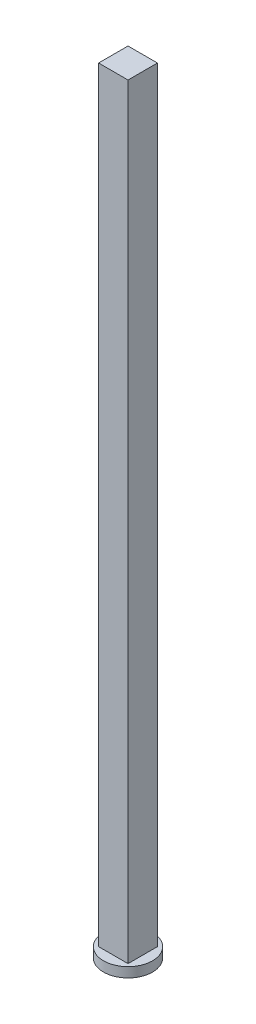
from build123d import *

# Parameters (mm, degrees)
ESQUISSE1_W             = 3
ESQUISSE1_H             = 3
BOSS_EXTRU_1_DEPTH      = 95
ESQUISSE2_R             = 2.5
BOSS_EXTRU_2_DEPTH      = 1
ESQUISSE3_W             = 3
ESQUISSE3_H             = 3
ENL_V_MAT_EXTRU_1_DEPTH = 17


with BuildPart() as part:
    # Esquisse1 → Boss.-Extru.1 (new body)
    with BuildSketch(Plane(origin=(0, 0, 0), x_dir=(1, 0, 0), z_dir=(0, 1, 0))):
        Rectangle(ESQUISSE1_W, ESQUISSE1_H)
    extrude(amount=BOSS_EXTRU_1_DEPTH)

    # Esquisse2 → Boss.-Extru.2 (add)
    with BuildSketch(Plane.XZ):
        with Locations(Location((0, 0, 0), (0, 0, 270))):
            Circle(ESQUISSE2_R)
    extrude(amount=BOSS_EXTRU_2_DEPTH)

    # Esquisse3 → Enlèv. mat.-Extru.1 (cut)
    with BuildSketch(Plane(origin=(0, 95, 0), x_dir=(1, 0, 0), z_dir=(0, 1, 0))):
        Rectangle(ESQUISSE3_W, ESQUISSE3_H)
    extrude(amount=-ENL_V_MAT_EXTRU_1_DEPTH, mode=Mode.SUBTRACT)


solid = part.part
